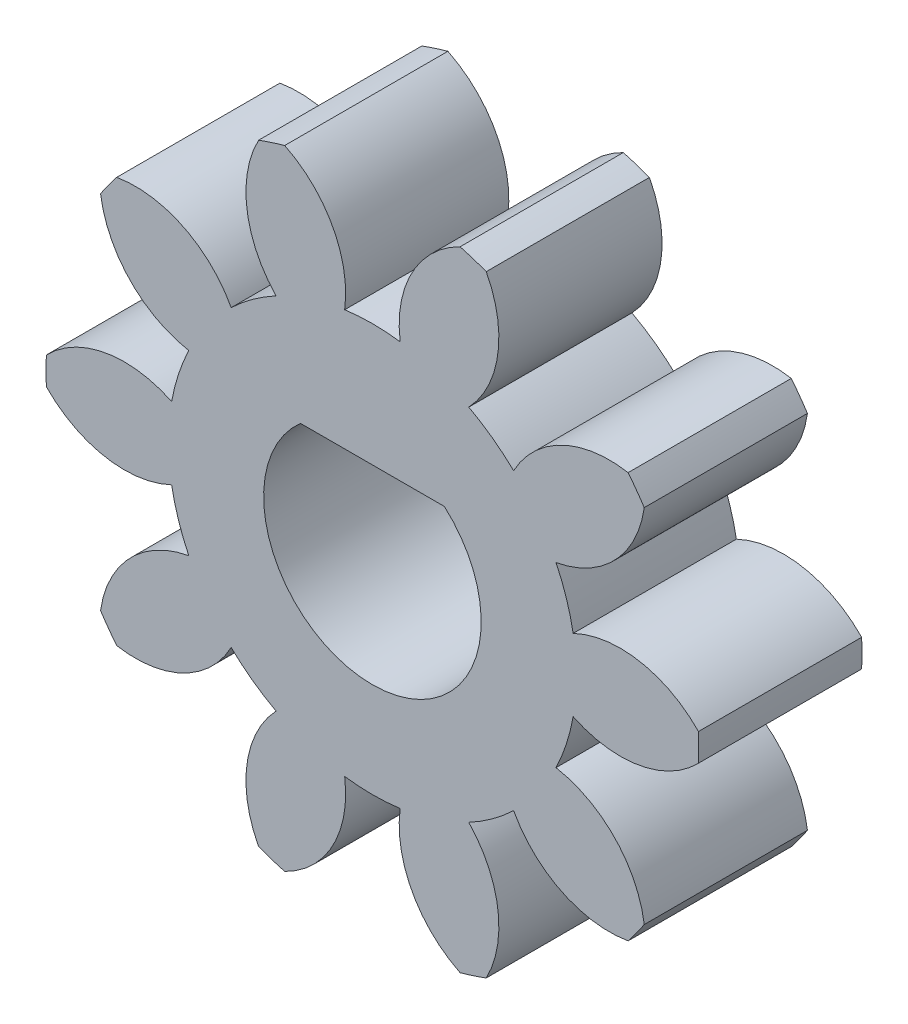
from build123d import *

# Parameters (mm, degrees)
SKETCH1_R           = 6
BOSS_EXTRUDE1_DEPTH = 3
CUT_EXTRUDE1_START  = -3
CUT_EXTRUDE1_DEPTH  = 3
CIRPATTERN1_COUNT   = 10
CUT_EXTRUDE3_DEPTH  = 9.854419488


with BuildPart() as part:
    # Sketch1 → Boss-Extrude1 (new body)
    with BuildSketch(Plane.XY):
        Circle(SKETCH1_R)
    extrude(amount=BOSS_EXTRUDE1_DEPTH)

    # Sketch2 → Cut-Extrude1 (cut)
    with BuildSketch(Plane.XY.offset(3).offset(CUT_EXTRUDE1_START)):
        with BuildLine():
            ThreePointArc((1.61222068, 5.77933772), (0.72770239, 4.925278691), (0.50996756, 3.715162592))
            ThreePointArc((0.50996756, 3.715162592), (0, 3.75), (-0.50996756, 3.715162592))
            ThreePointArc((-0.50996756, 3.715162592), (-0.72770239, 4.925278691), (-1.61222068, 5.77933772))
            ThreePointArc((-1.61222068, 5.77933772), (0, 6), (1.61222068, 5.77933772))
        make_face()
    cut_extrude1 = extrude(amount=CUT_EXTRUDE1_DEPTH, mode=Mode.SUBTRACT)

    # CirPattern1: Cut-Extrude1 ×10 about axis
    cirpattern1_axis = Axis((0, 0, 3), (0, 0, 1))
    for i in range(1, CIRPATTERN1_COUNT):
        add(cut_extrude1.rotate(cirpattern1_axis, i * 360 / CIRPATTERN1_COUNT), mode=Mode.SUBTRACT)

    # Sketch4 → Cut-Extrude3 (cut, through all)
    with BuildSketch(Plane.XY.offset(3)):
        with BuildLine():
            Line((-1.322875656, 1.5), (1.322875656, 1.5))
            ThreePointArc((1.322875656, 1.5), (0, -2), (-1.322875656, 1.5))
        make_face()
    extrude(amount=-CUT_EXTRUDE3_DEPTH, mode=Mode.SUBTRACT)


solid = part.part
